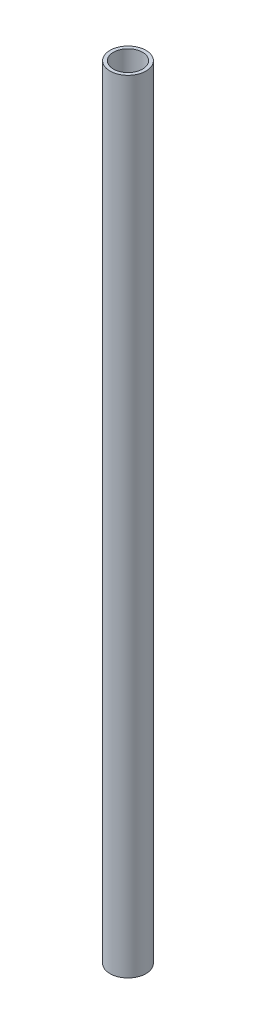
from build123d import *

# Parameters (mm, degrees)
SKETCH1_R           = 8
SKETCH1_R_2         = 6.5
BOSS_EXTRUDE1_DEPTH = 348


with BuildPart() as part:
    # Sketch1 → Boss-Extrude1 (new body)
    with BuildSketch(Plane(origin=(0, 0, 0), x_dir=(1, 0, 0), z_dir=(0, 1, 0))):
        with Locations(Location((0, 0, 0), (0, 0, 270))):
            Circle(SKETCH1_R)
        with Locations(Location((0, 0, 0), (0, 0, 270))):
            Circle(SKETCH1_R_2, mode=Mode.SUBTRACT)
    extrude(amount=BOSS_EXTRUDE1_DEPTH)


solid = part.part
